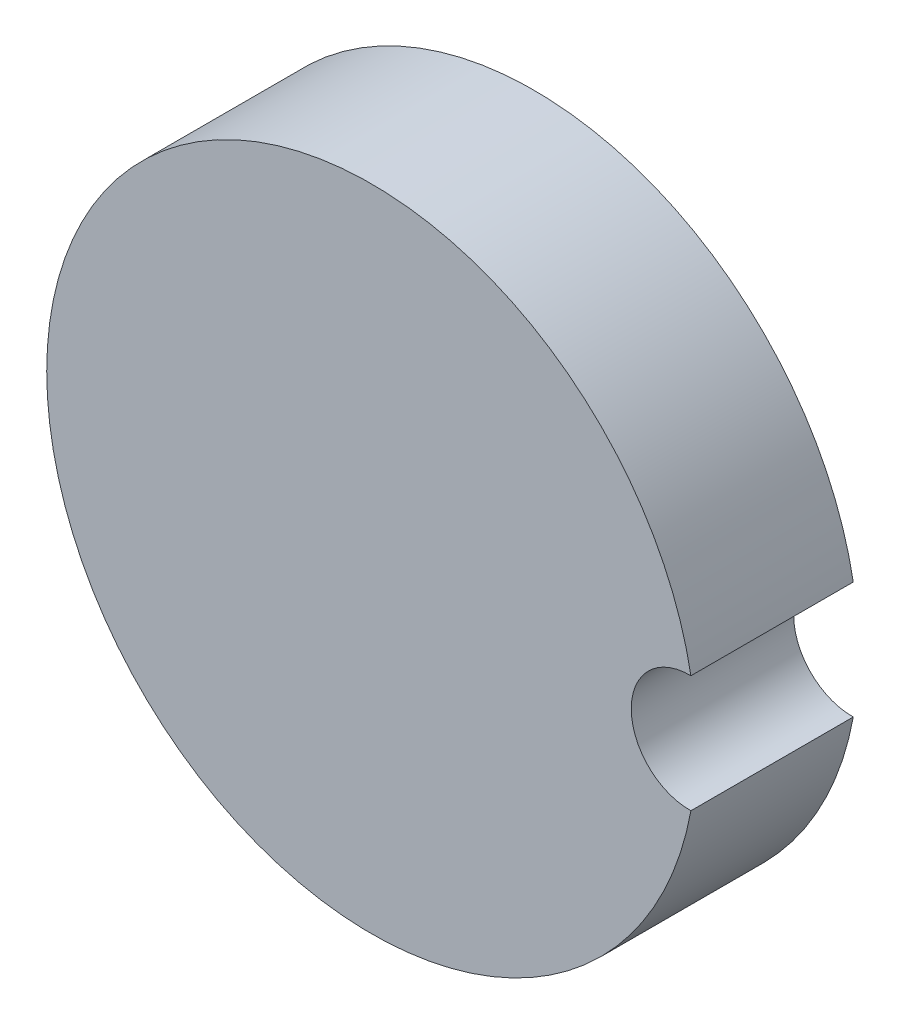
from build123d import *

# Parameters (mm, degrees)
SKETCH1_R           = 100
BOSS_EXTRUDE1_DEPTH = 50
SKETCH2_R           = 18
CUT_EXTRUDE1_DEPTH  = 50


with BuildPart() as part:
    # Sketch1 → Boss-Extrude1 (new body)
    with BuildSketch(Plane.XY):
        Circle(SKETCH1_R)
    extrude(amount=BOSS_EXTRUDE1_DEPTH)

    # Sketch2 → Cut-Extrude1 (cut)
    with BuildSketch(Plane.XY.offset(50)):
        with Locations((98, 0)):
            Circle(SKETCH2_R)
    extrude(amount=-CUT_EXTRUDE1_DEPTH, mode=Mode.SUBTRACT)


solid = part.part
